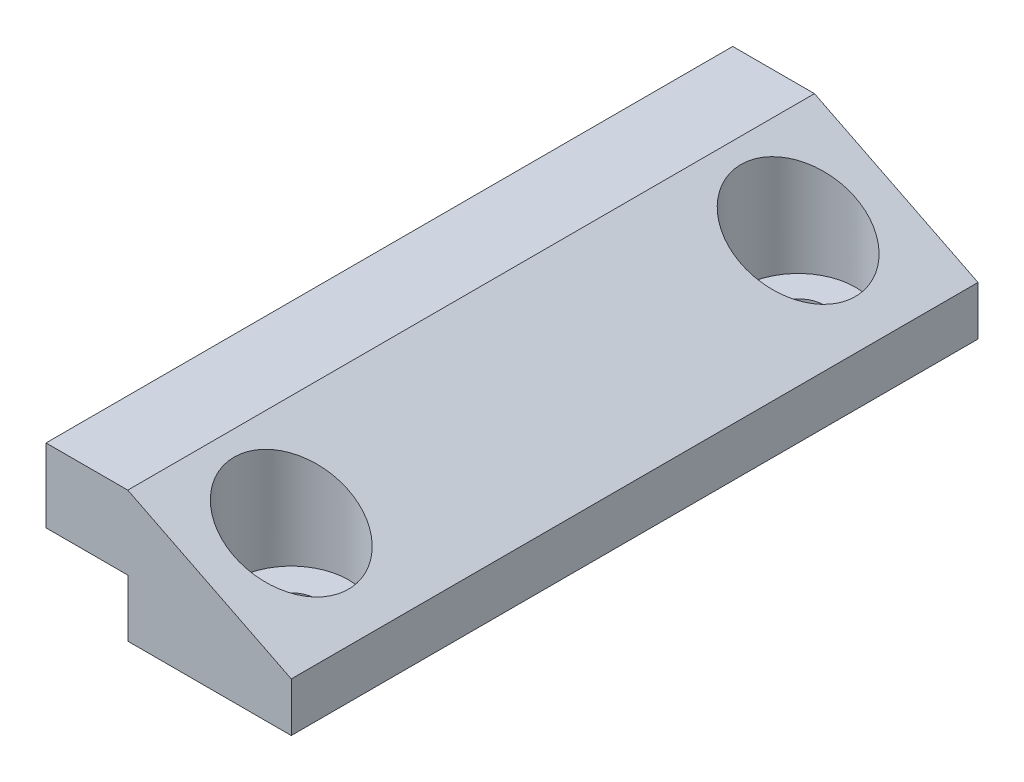
from build123d import *

# Parameters (mm, degrees)
BOSS_EXTRU_1_DEPTH      = 42
ESQUISSE2_R             = 2.5
ENL_V_MAT_EXTRU_1_DEPTH = 42
ESQUISSE4_R             = 3.5
ENL_V_MAT_EXTRU_2_DEPTH = 8.5
ENL_V_MAT_EXTRU_4_DEPTH = 47
BOSS_EXTRU_2_START      = -1
ESQUISSE6_R             = 3.5
ESQUISSE6_R_2           = 1.5
ESQUISSE6_R_3           = 1.6
BOSS_EXTRU_2_DEPTH      = 1


with BuildPart() as part:
    # Esquisse1 → Boss.-Extru.1 (new body)
    with BuildSketch(Plane.XY):
        Polygon((0, 3.5), (5, 3.5), (5, 0), (15, 0), (15, 8), (0, 8), align=None)
    extrude(amount=BOSS_EXTRU_1_DEPTH)

    # Esquisse2 → Enlèv. mat.-Extru.1 (cut)
    with BuildSketch(Plane(origin=(0, 8, 0), x_dir=(1, 0, 0), z_dir=(0, 1, 0))):
        with Locations(Location((9.5, -5.5, 0), (0, 0, 270))):
            Circle(ESQUISSE2_R)
        with Locations(Location((9.5, -36.5, 0), (0, 0, 270))):
            Circle(ESQUISSE2_R)
    extrude(amount=-ENL_V_MAT_EXTRU_1_DEPTH, mode=Mode.SUBTRACT)

    # Esquisse4 → Enlèv. mat.-Extru.2 (cut)
    with BuildSketch(Plane(origin=(0, 8, 0), x_dir=(1, 0, 0), z_dir=(0, 1, 0))):
        with Locations(Location((9.5, -5.5, 0), (0, 0, 270))):
            Circle(ESQUISSE4_R)
        with Locations(Location((9.5, -36.5, 0), (0, 0, 270))):
            Circle(ESQUISSE4_R)
    extrude(amount=-ENL_V_MAT_EXTRU_2_DEPTH, mode=Mode.SUBTRACT)

    # Esquisse5 → Enlèv. mat.-Extru.4 (cut)
    with BuildSketch(Plane.XY.offset(42)):
        Polygon((5, 8), (15, 3), (18.054100071, 8.962914679), (5.626380762, 14.083983342), align=None)
    extrude(amount=-ENL_V_MAT_EXTRU_4_DEPTH, mode=Mode.SUBTRACT)

    # Esquisse6 → Boss.-Extru.2 (add)
    # profile 1 of 2: a face of its own
    with BuildSketch(Plane(origin=(0, 0, 0), x_dir=(-1, 0, 0), z_dir=(0, -1, 0)).offset(BOSS_EXTRU_2_START)):
        with Locations((-9.5, -36.5)):
            Circle(ESQUISSE6_R)
        with Locations(Location((-9.5, -36.5, 0), (0, 0, 90))):
            Circle(ESQUISSE6_R_2, mode=Mode.SUBTRACT)
    # profile 2 of 2: a face of its own
    with BuildSketch(Plane(origin=(0, 0, 0), x_dir=(-1, 0, 0), z_dir=(0, -1, 0)).offset(BOSS_EXTRU_2_START)):
        with Locations((-9.5, -5.5)):
            Circle(ESQUISSE6_R)
        with Locations(Location((-9.5, -5.5, 0), (0, 0, 90))):
            Circle(ESQUISSE6_R_3, mode=Mode.SUBTRACT)
    extrude(amount=BOSS_EXTRU_2_DEPTH)


solid = part.part
